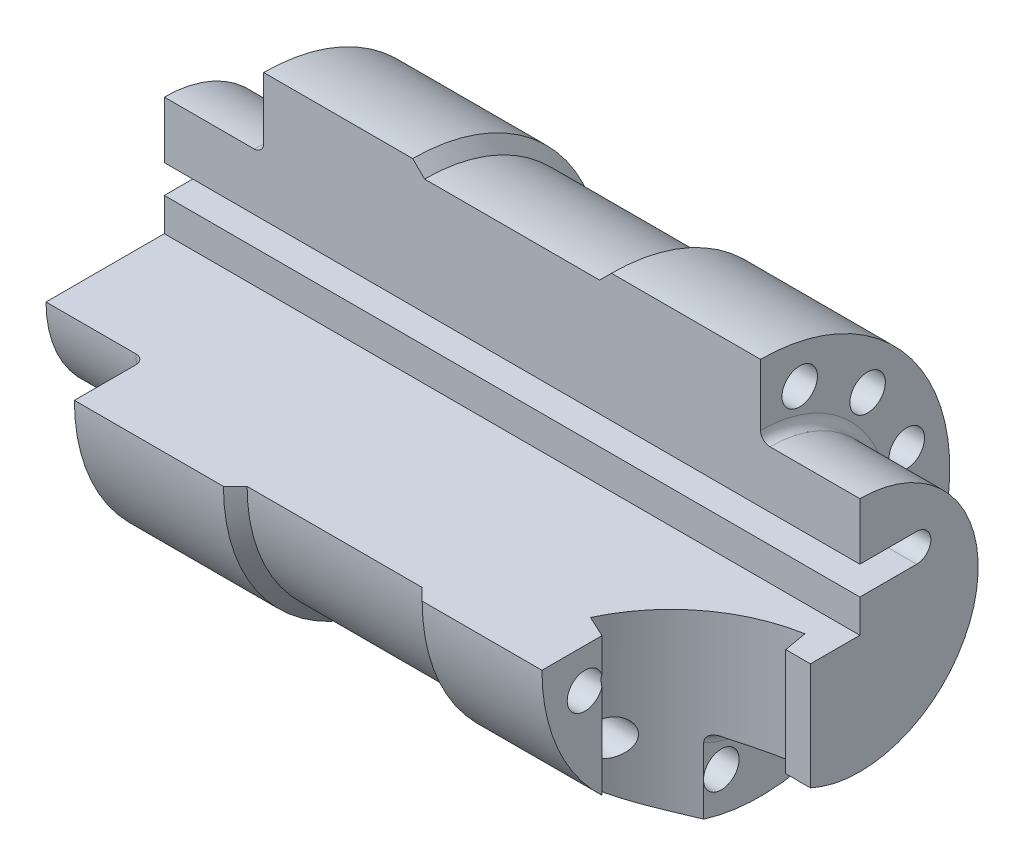
from build123d import *

# Parameters (mm, degrees)
ENL_V_MAT_EXTRU_1_DEPTH = 158.508729917
ESQUISSE3_R             = 3.75
ENL_V_MAT_EXTRU_2_DEPTH = 158.508729917
ENL_V_MAT_EXTRU_3_DEPTH = 131.348301481


with BuildPart() as part:
    # Esquisse1 → Révolution1 (revolve)
    with BuildSketch(Plane.XY, mode=Mode.PRIVATE) as r_volution1_sk:
        with BuildLine():
            Line((0, 0), (29.566275292, 0))
            Line((29.566275292, 0), (29.566275292, 25))
            Line((29.566275292, 25), (10.566275292, 25))
            ThreePointArc((10.566275292, 25), (9.152061729, 25.585786438), (8.566275292, 27))
            Line((8.566275292, 27), (8.566275292, 40))
            Line((8.566275292, 40), (-22.933724708, 40))
            Line((-22.933724708, 40), (-25.433724708, 37.5))
            Line((-25.433724708, 37.5), (-62.433724708, 37.5))
            Line((-62.433724708, 37.5), (-64.933724708, 40))
            Line((-64.933724708, 40), (-96.433724708, 40))
            Line((-96.433724708, 40), (-96.433724708, 27))
            ThreePointArc((-96.433724708, 27), (-97.019511146, 25.585786438), (-98.433724708, 25))
            Line((-98.433724708, 25), (-117.433724708, 25))
            Line((-117.433724708, 25), (-117.433724708, 0))
            Line((-117.433724708, 0), (0, 0))
        make_face()
    revolve(r_volution1_sk.sketch.rotate(Axis((-130.768922499, 0, 0), (1, 0, 0)), 90), axis=Axis((-130.768922499, 0, 0), (1, 0, 0)))

    # Esquisse2 → Enlèv. mat.-Extru.1 (cut, through all)
    with BuildSketch(Plane.ZY.offset(117.433724708)):
        with BuildLine():
            Line((0, 7), (0, 0))
            Line((0, 0), (43.449782835, 0))
            Line((43.449782835, 0), (43.449782835, 44.497429883))
            Line((43.449782835, 44.497429883), (0, 44.497429883))
            Line((0, 44.497429883), (0, 13))
            ThreePointArc((0, 13), (3, 10), (0, 7))
        make_face()
        with BuildLine():
            Line((-12, 7), (0, 7))
            ThreePointArc((0, 7), (3, 10), (0, 13))
            Line((0, 13), (-12, 13))
            ThreePointArc((-12, 13), (-15, 10), (-12, 7))
        make_face()
    extrude(amount=-ENL_V_MAT_EXTRU_1_DEPTH, mode=Mode.SUBTRACT)

    # Esquisse3 → Enlèv. mat.-Extru.2 (cut, through all)
    with BuildSketch(Plane.ZY.offset(117.433724708)):
        with BuildLine():
            ThreePointArc((-9.252780862, 34.53184829), (-11.904431292, 29.939055022), (-7.311638024, 27.287404593))
            Line((-7.311638024, 27.287404593), (-9.252780862, 34.53184829))
        make_face()
        with BuildLine():
            Line((-9.252780862, 34.53184829), (-7.311638024, 27.287404593))
            ThreePointArc((-7.311638024, 27.287404593), (-5.307134417, 28.626771082), (-4.532209443, 30.909626441))
            ThreePointArc((-4.532209443, 30.909626441), (-5.999354084, 33.884701467), (-9.252780862, 34.53184829))
        make_face()
        with Locations((-22.627416998, 22.627416998)):
            Circle(ESQUISSE3_R)
        with Locations((-30.909626441, 8.282209443)):
            Circle(ESQUISSE3_R)
        with Locations((-30.909626441, -8.282209443)):
            Circle(ESQUISSE3_R)
        with Locations((-22.627416998, -22.627416998)):
            Circle(ESQUISSE3_R)
        with Locations((-8.282209443, -30.909626441)):
            Circle(ESQUISSE3_R)
        with Locations((8.282209443, -30.909626441)):
            Circle(ESQUISSE3_R)
        with Locations((22.627416998, -22.627416998)):
            Circle(ESQUISSE3_R)
        with Locations((30.909626441, -8.282209443)):
            Circle(ESQUISSE3_R)
    extrude(amount=-ENL_V_MAT_EXTRU_2_DEPTH, mode=Mode.SUBTRACT)

    # Esquisse4 → Enlèv. mat.-Extru.3 (cut, through all)
    with BuildSketch(Plane(origin=(0, 0, 0), x_dir=(1, 0, 0), z_dir=(0, 1, 0))):
        Polygon((8.566275292, -30.207539179), (2.377041681, -27.321452148), (2.377041681, -40), (8.566275292, -40), align=None)
        with BuildLine():
            Line((26.921370581, -25), (24.356829962, -10.45576741))
            ThreePointArc((24.356829962, -10.45576741), (11.303432421, -16.199399791), (2.377041681, -27.321452148))
            Line((2.377041681, -27.321452148), (8.566275292, -30.207539179))
            Line((8.566275292, -30.207539179), (8.566275292, -27))
            ThreePointArc((8.566275292, -27), (9.152061729, -25.585786438), (10.566275292, -25))
            Line((10.566275292, -25), (26.921370581, -25))
        make_face()
        with BuildLine():
            ThreePointArc((2.377041681, -27.321452148), (11.303432421, -16.199399791), (24.356829962, -10.45576741))
            Line((24.356829962, -10.45576741), (23.488589073, -5.531728645))
            ThreePointArc((23.488589073, -5.531728645), (8.259625276, -12.23263309), (-2.154497255, -25.208360839))
            Line((-2.154497255, -25.208360839), (2.377041681, -27.321452148))
        make_face()
        Polygon((29.566275292, -10.45576741), (24.356829962, -10.45576741), (26.921370581, -25), (29.566275292, -25), align=None)
    extrude(amount=-ENL_V_MAT_EXTRU_3_DEPTH, mode=Mode.SUBTRACT)


solid = part.part
